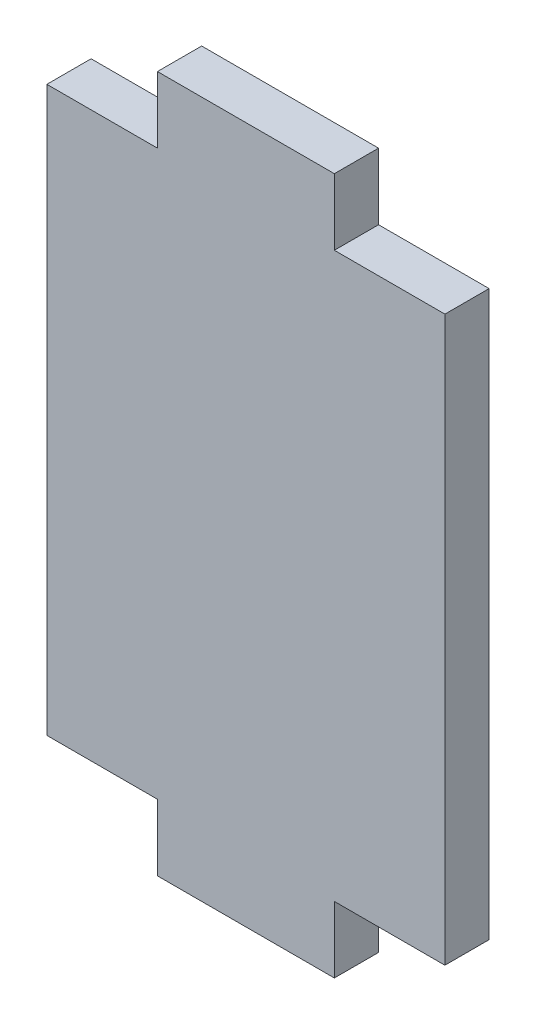
from build123d import *

# Parameters (mm, degrees)
EXTRUDE_1_DEPTH = 2


with BuildPart() as part:
    # 草图1 → 凸台-拉伸1 (new body)
    with BuildSketch(Plane.XY):
        Polygon((0, 0), (-8, 0), (-8, -3), (-13, -3), (-13, -28.5), (-8, -28.5), (-8, -31.5), (0, -31.5), (0, -28.5), (5, -28.5), (5, -3), (0, -3), align=None)
    extrude(amount=EXTRUDE_1_DEPTH)


solid = part.part
